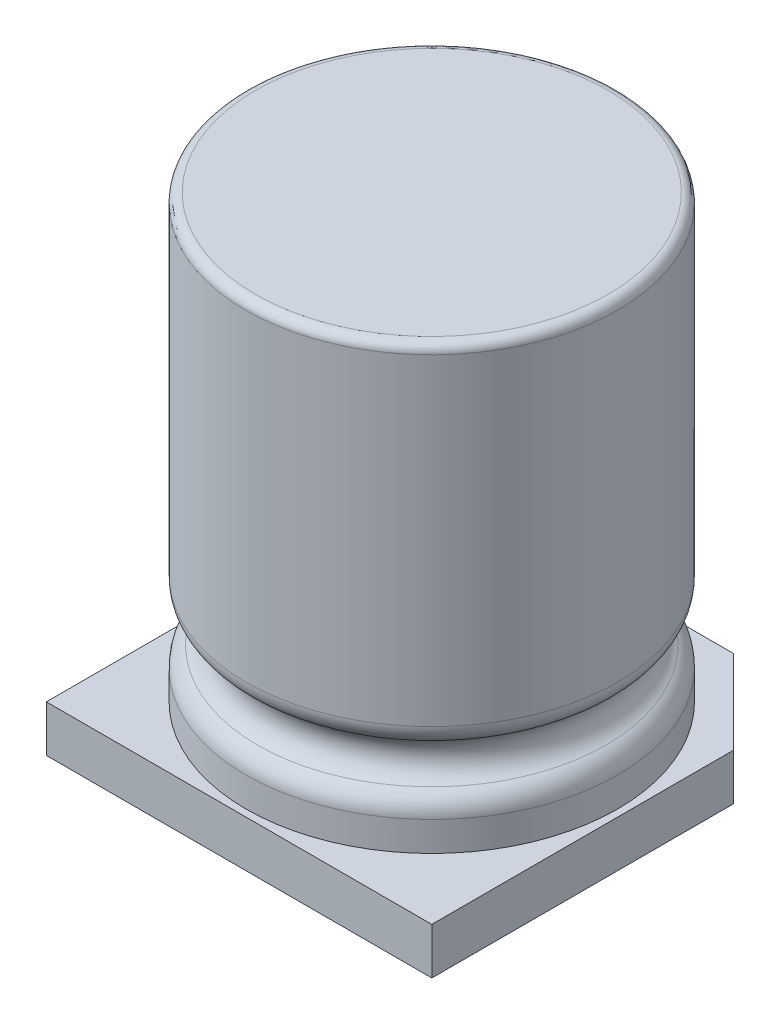
from build123d import *

# Parameters (mm, degrees)
SKETCH1_W           = 8.3
SKETCH1_H           = 8.3
BOSS_EXTRUDE1_DEPTH = 1
SKETCH2_R           = 4
BOSS_EXTRUDE2_DEPTH = 9.5
SKETCH3_R           = 0.5
FILLET1_R           = 0.5
FILLET2_R           = 0.2
CHAMFER1_SIZE       = 1.8


with BuildPart() as part:
    # Sketch1 → Boss-Extrude1 (new body)
    with BuildSketch(Plane(origin=(0, 0, 0), x_dir=(1, 0, 0), z_dir=(0, 1, 0))):
        Rectangle(SKETCH1_W, SKETCH1_H)
    extrude(amount=BOSS_EXTRUDE1_DEPTH)

    # Chamfer1
    chamfer1_edges = [part.edges().sort_by_distance(p)[0] for p in [
        (-4.15, 0.5, -4.15),
        (4.15, 0.5, -4.15),
    ]]
    chamfer(chamfer1_edges, length=CHAMFER1_SIZE)


with BuildPart() as body_2:
    # Sketch2 → Boss-Extrude2 (new body)
    with BuildSketch(Plane(origin=(0, 1, 0), x_dir=(1, 0, 0), z_dir=(0, 1, 0))):
        with Locations(Location((0, 0, 0), (0, 0, 270))):
            Circle(SKETCH2_R)
    extrude(amount=BOSS_EXTRUDE2_DEPTH)

    # Sketch3 → Cut-Revolve1 (revolve, cut)
    with BuildSketch(Plane.XY, mode=Mode.PRIVATE) as cut_revolve1_sk:
        with Locations((4, 2.5)):
            Circle(SKETCH3_R)
    revolve(cut_revolve1_sk.sketch.rotate(Axis((0, 10.5, 0), (0, -1, 0)), 90), axis=Axis((0, 10.5, 0), (0, -1, 0)), mode=Mode.SUBTRACT)

    # Fillet1
    fillet1_edges = [body_2.edges().sort_by_distance(p)[0] for p in [
        (0, 3, -4),
        (0, 2, -4),
    ]]
    fillet(fillet1_edges, radius=FILLET1_R)

    # Fillet2
    fillet2_edges = [body_2.edges().sort_by_distance(p)[0] for p in [
        (0, 10.5, -4),
    ]]
    fillet(fillet2_edges, radius=FILLET2_R)


solid = Compound([part.part, body_2.part])
